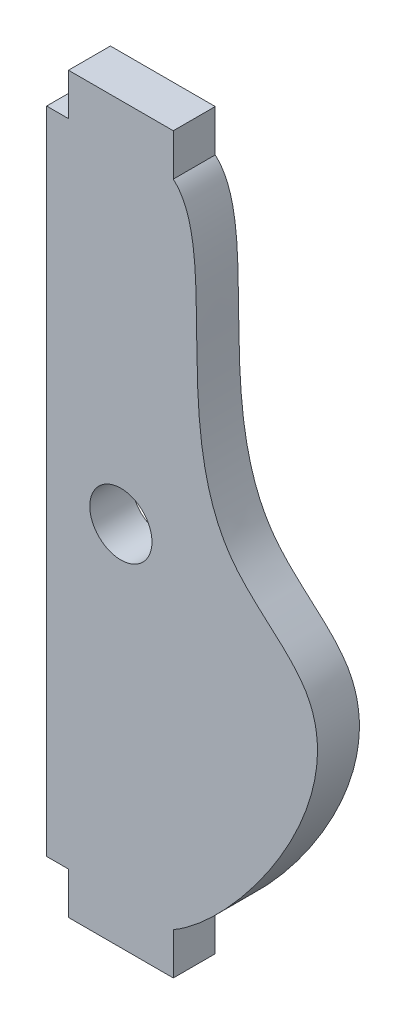
from build123d import *

# Parameters (mm, degrees)
CROQUIS1_W              = 5
CROQUIS1_H              = 2
CROQUIS1_R              = 1.48280389
SALIENTE_EXTRUIR1_DEPTH = 2


with BuildPart() as part:
    # Croquis1 → Saliente-Extruir1 (new body)
    # profile 1 of 3: a face of its own
    with BuildSketch(Plane.XY):
        with Locations((0, 16.5)):
            Rectangle(CROQUIS1_W, CROQUIS1_H)
    # profile 2 of 3: a face of its own
    with BuildSketch(Plane.XY):
        with BuildLine():
            Line((2.5, 15.5), (-2.5, 15.5))
            Line((-2.5, 15.5), (-3.542279833, 15.5))
            Line((-3.542279833, 15.5), (-3.542279833, -15.5))
            Line((-3.542279833, -15.5), (-2.5, -15.5))
            Line((-2.5, -15.5), (2.5, -15.5))
            add(Edge.make_bspline(
                [(2.5, 15.5), (4.778408881, 13.483435517), (1.403134335, 2.447360993), (13.063981649, -3.922799688), (5.481738283, -13.819921802), (2.5, -15.5)],
                knots=[0, 0, 0, 0, 0.423142863, 0.573502556, 1, 1, 1, 1], degree=3))
        make_face()
        Circle(CROQUIS1_R, mode=Mode.SUBTRACT)
    # profile 3 of 3: a face of its own
    with BuildSketch(Plane.XY):
        with Locations((0, -16.5)):
            Rectangle(CROQUIS1_W, CROQUIS1_H)
    extrude(amount=SALIENTE_EXTRUIR1_DEPTH)


solid = part.part
